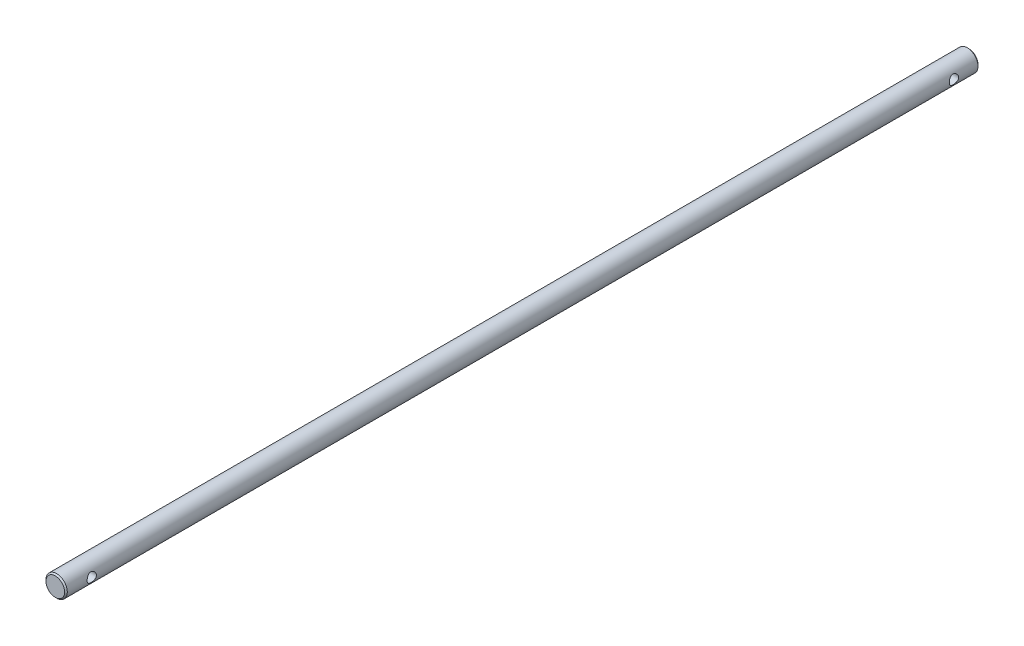
from build123d import *

# Parameters (mm, degrees)
SKETCH1_R           = 4
BOSS_EXTRUDE1_DEPTH = 342.9
CHAMFER1_SIZE       = 0.5
SKETCH3_R           = 1.7526
CUT_EXTRUDE1_DEPTH  = 344.01663225


with BuildPart() as part:
    # Sketch1 → Boss-Extrude1 (new body)
    with BuildSketch(Plane.XY):
        Circle(SKETCH1_R)
    extrude(amount=BOSS_EXTRUDE1_DEPTH)

    # Chamfer1
    chamfer1_edges = [part.edges().sort_by_distance(p)[0] for p in [
        (-4, 0, 0),
        (-4, 0, 342.9),
    ]]
    chamfer(chamfer1_edges, length=CHAMFER1_SIZE)

    # Sketch3 → Cut-Extrude1 (cut, through all)
    with BuildSketch(Plane.ZY.offset(4)):
        with Locations((9.525, 0)):
            Circle(SKETCH3_R)
        with Locations((333.188999311, 0)):
            Circle(SKETCH3_R)
    extrude(amount=-CUT_EXTRUDE1_DEPTH, mode=Mode.SUBTRACT)


solid = part.part
